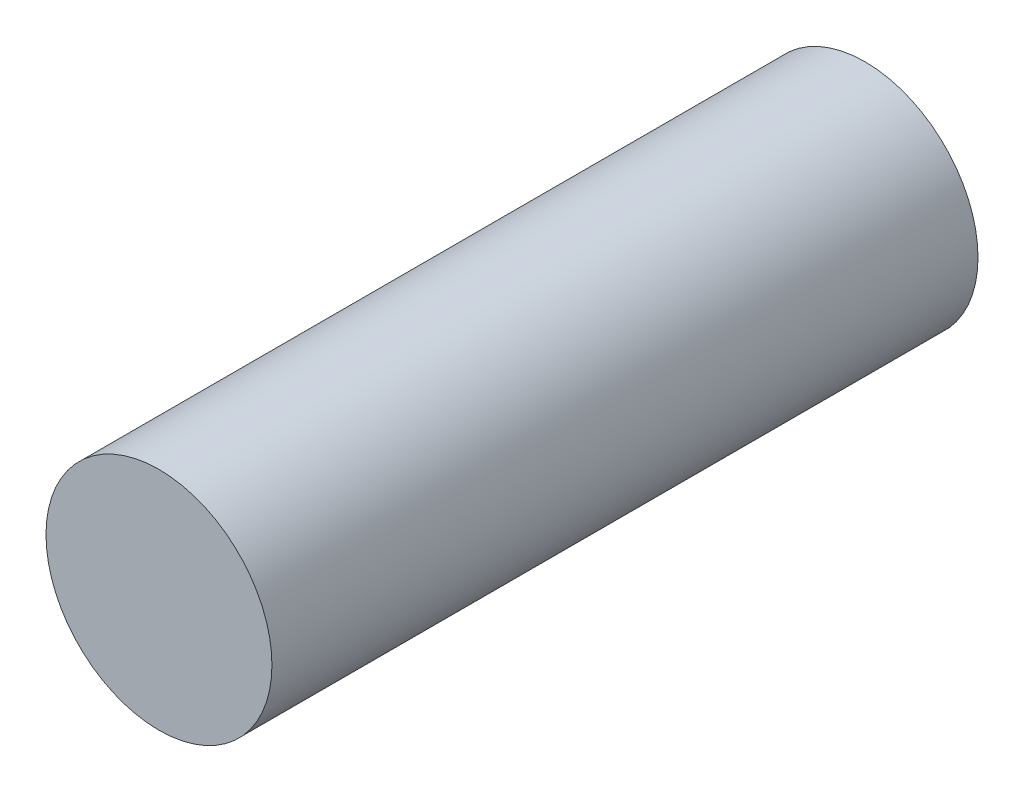
from build123d import *

# Parameters (mm, degrees)
CROQUIS1_R              = 4
SALIENTE_EXTRUIR1_DEPTH = 25


with BuildPart() as part:
    # Croquis1 → Saliente-Extruir1 (new body)
    with BuildSketch(Plane.XY):
        Circle(CROQUIS1_R)
    extrude(amount=SALIENTE_EXTRUIR1_DEPTH)


solid = part.part
